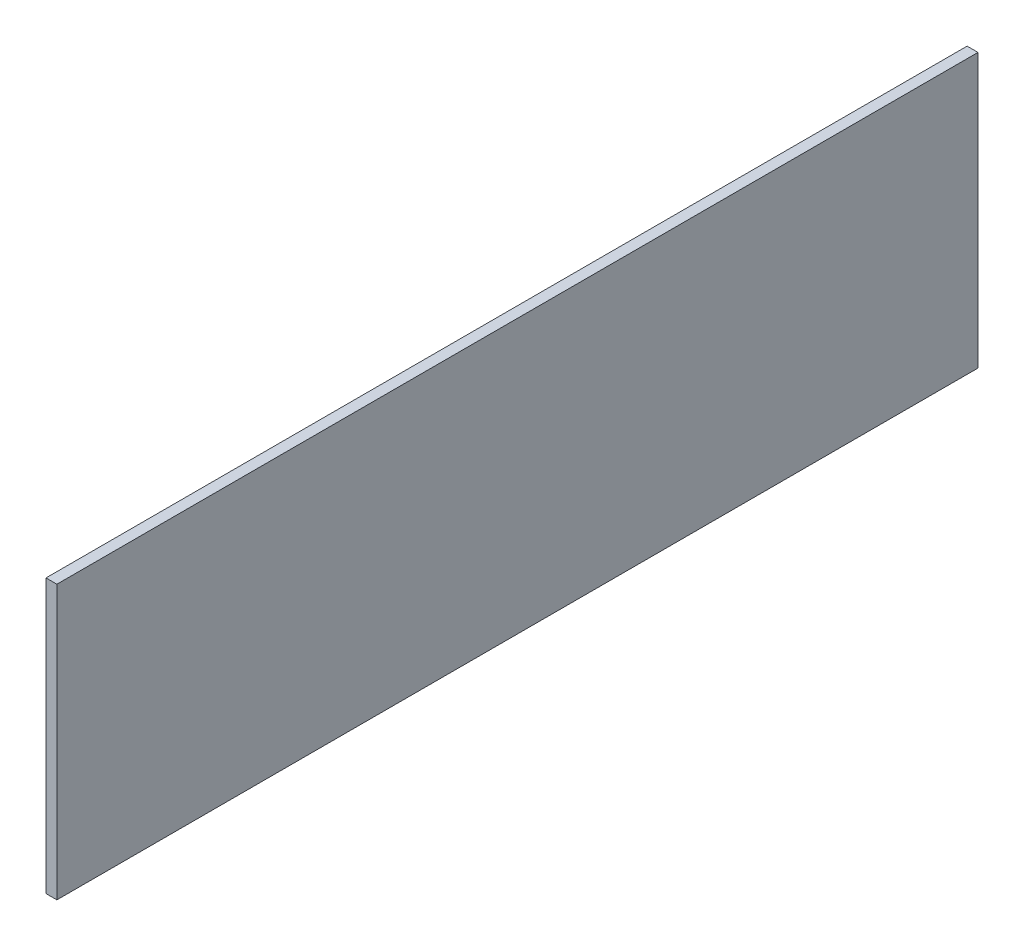
from build123d import *

# Parameters (mm, degrees)
CROQUIS1_W              = 1.1
CROQUIS1_H              = 27.602886177
SALIENTE_EXTRUIR1_DEPTH = 93


with BuildPart() as part:
    # Croquis1 → Saliente-Extruir1 (new body)
    with BuildSketch(Plane.XY):
        with Locations((84.564275766, -15.003684891)):
            Rectangle(CROQUIS1_W, CROQUIS1_H)
    extrude(amount=SALIENTE_EXTRUIR1_DEPTH)


solid = part.part
